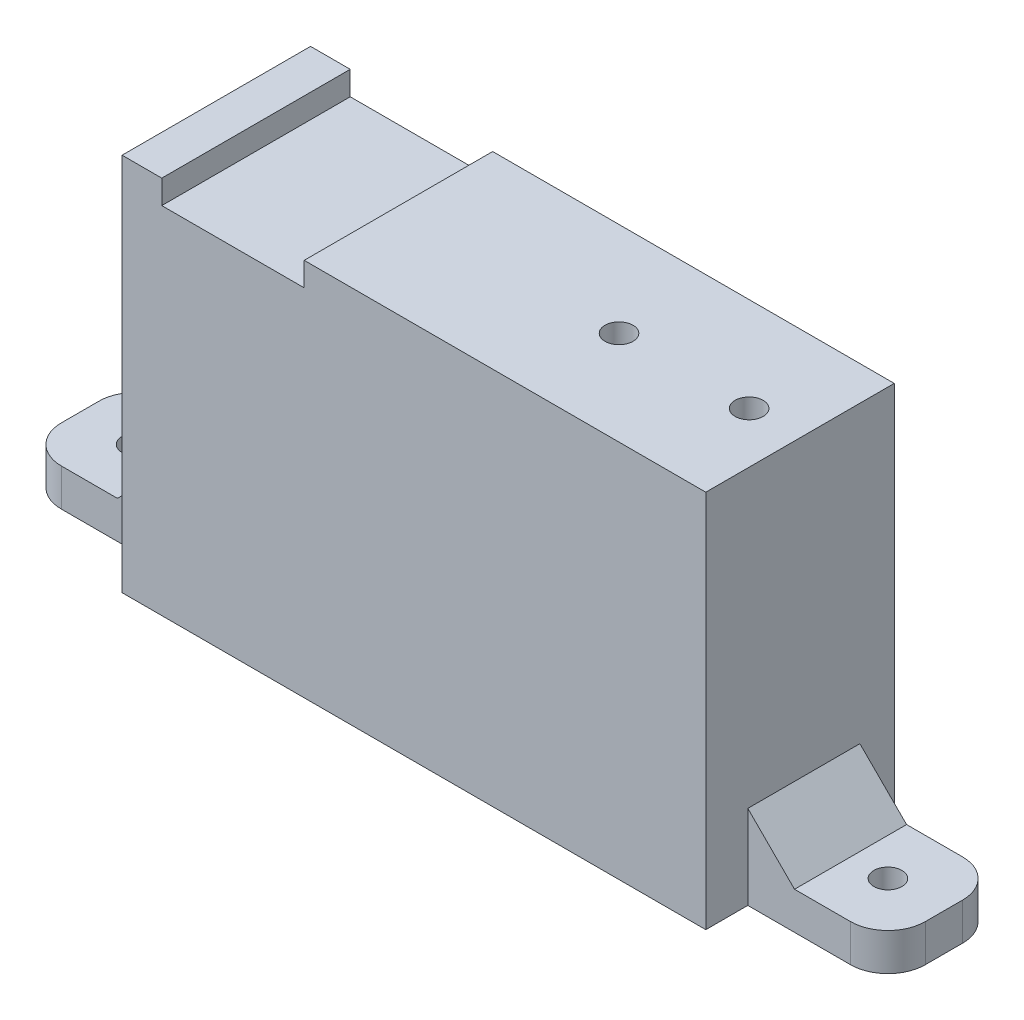
from build123d import *

# Parameters (mm, degrees)
SKETCH_219_W        = 62.5
SKETCH_219_H        = 20.18
EXTRUDE_1_DEPTH     = 40.57
SKETCH_6_W          = 15.25
SKETCH_6_H          = 20.18
CUT_EXTRUDE_1_DEPTH = 2.55
SKETCH_7_R          = 1.5
CUT_EXTRUDE_2_DEPTH = 15
SKETCH_8_R          = 1.5
EXTRUDE_2_DEPTH     = 4
CHAMFER_1_SIZE      = 5
CHAMFER_2_SIZE      = 5


with BuildPart() as part:
    # Sketch 219 → Бобышка-Вытянуть1 (new body)
    with BuildSketch(Plane(origin=(0, 0, 0), x_dir=(1, 0, 0), z_dir=(0, 1, 0))):
        Rectangle(SKETCH_219_W, SKETCH_219_H)
    extrude(amount=EXTRUDE_1_DEPTH)

    # Эскиз6 → Вырез-Вытянуть1 (cut)
    with BuildSketch(Plane(origin=(0, 40.57, 0), x_dir=(1, 0, 0), z_dir=(0, 1, 0))):
        with Locations((-19.375, 0)):
            Rectangle(SKETCH_6_W, SKETCH_6_H)
    extrude(amount=-CUT_EXTRUDE_1_DEPTH, mode=Mode.SUBTRACT)

    # Эскиз7 → Вырез-Вытянуть2 (cut)
    with BuildSketch(Plane(origin=(0, 40.57, 0), x_dir=(1, 0, 0), z_dir=(0, 1, 0))):
        with BuildLine():
            ThreePointArc((27.3, 0), (25.8, 1.5), (24.3, 0))
            Line((24.3, 0), (27.3, 0))
        make_face()
        with BuildLine():
            Line((27.3, 0), (24.3, 0))
            ThreePointArc((24.3, 0), (25.8, -1.5), (27.3, 0))
        make_face()
        with Locations(Location((11.87, 0, 0), (0, 0, 270))):
            Circle(SKETCH_7_R)
    extrude(amount=-CUT_EXTRUDE_2_DEPTH, mode=Mode.SUBTRACT)

    # Эскиз8 → Бобышка-Вытянуть2 (add)
    # profile 1 of 2: a face of its own
    with BuildSketch(Plane.XZ):
        with BuildLine():
            Line((-31.25, 5.59), (-42.25, 5.59))
            ThreePointArc((-42.25, 5.59), (-45.078427125, 4.418427125), (-46.25, 1.59))
            Line((-46.25, 1.59), (-46.25, -2.41))
            ThreePointArc((-46.25, -2.41), (-45.078427125, -5.238427125), (-42.25, -6.41))
            Line((-42.25, -6.41), (-31.25, -6.41))
            Line((-31.25, -6.41), (-31.25, 5.59))
        make_face()
        with Locations(Location((-40.25, -0.41, 0), (0, 0, 270))):
            Circle(SKETCH_8_R, mode=Mode.SUBTRACT)
    # profile 2 of 2: a face of its own
    with BuildSketch(Plane.XZ):
        with BuildLine():
            Line((31.25, -6.41), (42.25, -6.41))
            ThreePointArc((42.25, -6.41), (45.078427125, -5.238427125), (46.25, -2.41))
            Line((46.25, -2.41), (46.25, 1.59))
            ThreePointArc((46.25, 1.59), (45.078427125, 4.418427125), (42.25, 5.59))
            Line((42.25, 5.59), (31.25, 5.59))
            Line((31.25, 5.59), (31.25, -6.41))
        make_face()
        with Locations(Location((40.25, -0.41, 0), (0, 0, 90))):
            Circle(SKETCH_8_R, mode=Mode.SUBTRACT)
    extrude(amount=-EXTRUDE_2_DEPTH)

    # Фаска1
    chamfer_1_edges = [part.edges().sort_by_distance(p)[0] for p in [
        (-31.25, 4, -0.41),
    ]]
    chamfer(chamfer_1_edges, length=CHAMFER_1_SIZE)

    # Фаска2
    chamfer_2_edges = [part.edges().sort_by_distance(p)[0] for p in [
        (31.25, 4, -0.41),
    ]]
    chamfer(chamfer_2_edges, length=CHAMFER_2_SIZE)


solid = part.part
